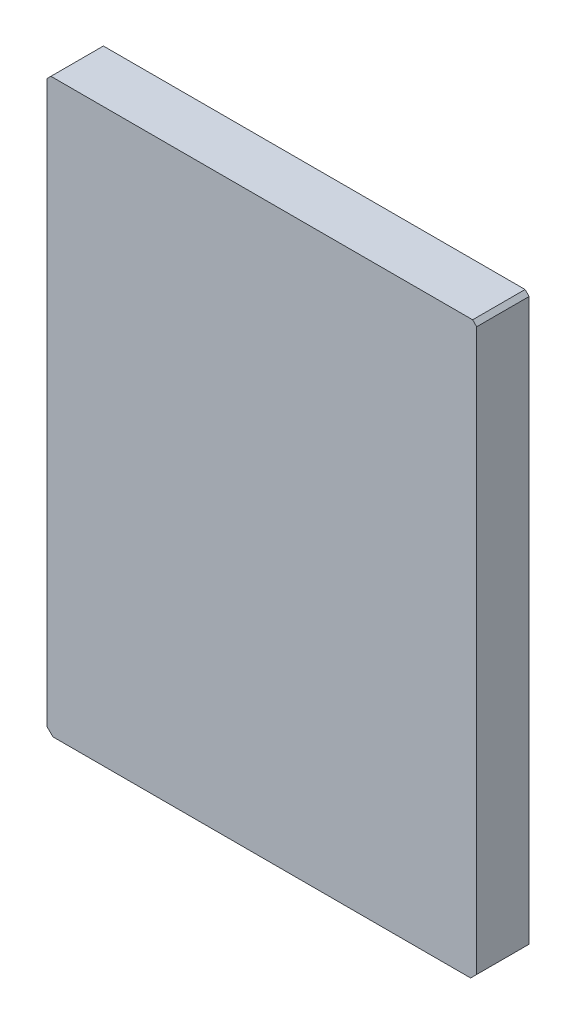
from build123d import *

# Parameters (mm, degrees)
SKETCH1_W           = 100.5
SKETCH1_H           = 134.5
BOSS_EXTRUDE1_DEPTH = 2
SKETCH2_W           = 104.5
SKETCH2_H           = 138.5
SKETCH2_W_2         = 100.5
SKETCH2_H_2         = 134.5
BOSS_EXTRUDE2_DEPTH = 13
BOSS_EXTRUDE3_DEPTH = 2
SKETCH5_W           = 104.5
SKETCH5_H           = 13
BOSS_EXTRUDE4_DEPTH = 2
CUT_EXTRUDE2_DEPTH  = 2
SKETCH8_W           = 5
SKETCH8_H           = 4
BOSS_EXTRUDE5_DEPTH = 12
FILLET1_R           = 4
CUT_EXTRUDE3_DEPTH  = 20
BOSS_EXTRUDE7_DEPTH = 13
CHAMFER1_SIZE       = 1.5
FILLET2_R           = 1


with BuildPart() as part:
    # Sketch1 → Boss-Extrude1 (new body)
    with BuildSketch(Plane.XY):
        with Locations((50.25, -67.25)):
            Rectangle(SKETCH1_W, SKETCH1_H)
    extrude(amount=BOSS_EXTRUDE1_DEPTH)

    # Sketch2 → Boss-Extrude2 (add)
    with BuildSketch(Plane.XY.offset(2)):
        with Locations((50.25, -67.25)):
            Rectangle(SKETCH2_W, SKETCH2_H)
        with Locations((50.25, -67.25)):
            Rectangle(SKETCH2_W_2, SKETCH2_H_2, mode=Mode.SUBTRACT)
    extrude(amount=-BOSS_EXTRUDE2_DEPTH)

    # Sketch3 → Boss-Extrude3 (add)
    with BuildSketch(Plane(origin=(0, 0, 0), x_dir=(-1, 0, 0), z_dir=(0, 0, -1))):
        Polygon((-52.25, 0), (-52.25, -70), (-101.125, -70), (-101.125, -74), (0.625, -74), (0.625, -70), (-48.25, -70), (-48.25, 0), align=None)
    extrude(amount=BOSS_EXTRUDE3_DEPTH)

    # Sketch5 → Boss-Extrude4 (add)
    with BuildSketch(Plane.XZ.offset(136.5)):
        with Locations((50.25, -4.5)):
            Rectangle(SKETCH5_W, SKETCH5_H)
    extrude(amount=BOSS_EXTRUDE4_DEPTH)

    # Sketch4 → Cut-Extrude2 (cut)
    with BuildSketch(Plane.XZ.offset(138.5)):
        with BuildLine():
            Line((89.65, -8.25), (89.65, -11))
            Line((89.65, -11), (85.85, -11))
            Line((85.85, -11), (85.85, -8.25))
            ThreePointArc((85.85, -8.25), (87.75, -6.35), (89.65, -8.25))
        make_face()
        with BuildLine():
            Line((14.65, -8.25), (14.65, -11))
            Line((14.65, -11), (10.85, -11))
            Line((10.85, -11), (10.85, -8.25))
            ThreePointArc((10.85, -8.25), (12.75, -6.35), (14.65, -8.25))
        make_face()
    extrude(amount=-CUT_EXTRUDE2_DEPTH, mode=Mode.SUBTRACT)

    # Sketch8 → Boss-Extrude5 (add)
    with BuildSketch(Plane(origin=(0, 0, 0), x_dir=(-1, 0, 0), z_dir=(0, 0, -1))):
        with Locations((-12.75, -118.5)):
            Rectangle(SKETCH8_W, SKETCH8_H)
        with Locations((-87.75, -118.5)):
            Rectangle(SKETCH8_W, SKETCH8_H)
    extrude(amount=BOSS_EXTRUDE5_DEPTH)

    # Fillet1
    fillet1_edges = [part.edges().sort_by_distance(p)[0] for p in [
        (10.25, -118.5, 0),
        (12.75, -116.5, 0),
        (15.25, -118.5, 0),
        (12.75, -120.5, 0),
        (85.25, -118.5, 0),
        (87.75, -116.5, 0),
        (90.25, -118.5, 0),
        (87.75, -120.5, 0),
    ]]
    fillet(fillet1_edges, radius=FILLET1_R)

    # Sketch7 → Cut-Extrude3 (cut)
    with BuildSketch(Plane.XZ.offset(136.5)):
        with BuildLine():
            Line((88.75, -8.25), (88.75, -11))
            Line((88.75, -11), (86.75, -11))
            Line((86.75, -11), (86.75, -8.25))
            ThreePointArc((86.75, -8.25), (87.75, -7.25), (88.75, -8.25))
        make_face()
        with BuildLine():
            Line((13.75, -8.25), (13.75, -11))
            Line((13.75, -11), (11.75, -11))
            Line((11.75, -11), (11.75, -8.25))
            ThreePointArc((11.75, -8.25), (12.75, -7.25), (13.75, -8.25))
        make_face()
    extrude(amount=-CUT_EXTRUDE3_DEPTH, mode=Mode.SUBTRACT)

    # Sketch13 → Boss-Extrude7 (add)
    with BuildSketch(Plane(origin=(0, 0, -11), x_dir=(-1, 0, 0), z_dir=(0, 0, -1))):
        Polygon((2, -138.5), (3, -138.5), (3, 2), (2, 3), (-102.5, 3), (-103.5, 2), (-103.5, -138.5), (-102.5, -138.5), (-102.5, 2), (2, 2), align=None)
    extrude(amount=-BOSS_EXTRUDE7_DEPTH)

    # Chamfer1
    chamfer1_edges = [part.edges().sort_by_distance(p)[0] for p in [
        (-3, -138.5, -4.5),
        (103.5, -138.5, -4.5),
    ]]
    chamfer(chamfer1_edges, length=CHAMFER1_SIZE)

    # Fillet2
    fillet2_edges = [part.edges().sort_by_distance(p)[0] for p in [
        (76.375, -70, 0),
        (50.25, -74, 0),
        (48.25, -35, 0),
        (24.125, -70, 0),
        (52.25, -35, 0),
    ]]
    fillet(fillet2_edges, radius=FILLET2_R)


solid = part.part
